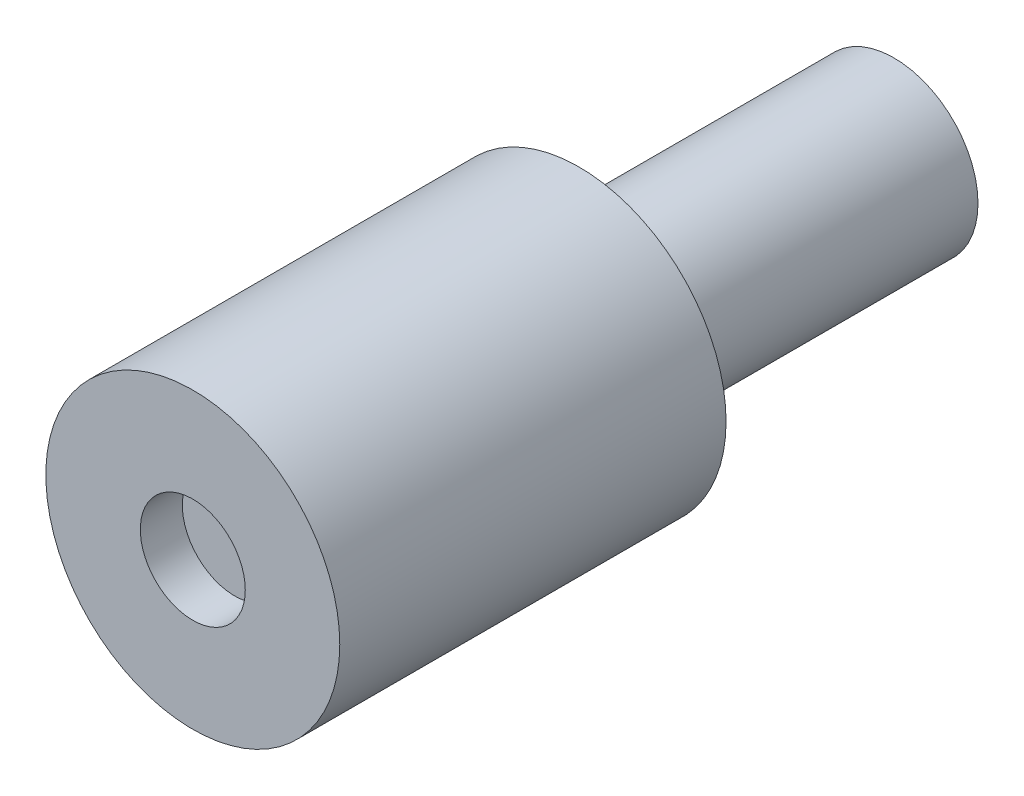
from build123d import *

# Parameters (mm, degrees)
SKETCH1_R           = 4
BOSS_EXTRUDE1_DEPTH = 15
SKETCH3_R           = 7
BOSS_EXTRUDE3_DEPTH = 18.4
SKETCH5_R           = 2.5
CUT_EXTRUDE2_DEPTH  = 2


with BuildPart() as part:
    # Sketch1 → Boss-Extrude1 (new body)
    with BuildSketch(Plane.XY):
        Circle(SKETCH1_R)
    extrude(amount=BOSS_EXTRUDE1_DEPTH)

    # Sketch3 → Boss-Extrude3 (add)
    with BuildSketch(Plane.XY.offset(15)):
        Circle(SKETCH3_R)
    extrude(amount=BOSS_EXTRUDE3_DEPTH)

    # Sketch5 → Cut-Extrude2 (cut)
    with BuildSketch(Plane.XY.offset(33.4)):
        Circle(SKETCH5_R)
    extrude(amount=-CUT_EXTRUDE2_DEPTH, mode=Mode.SUBTRACT)


solid = part.part
